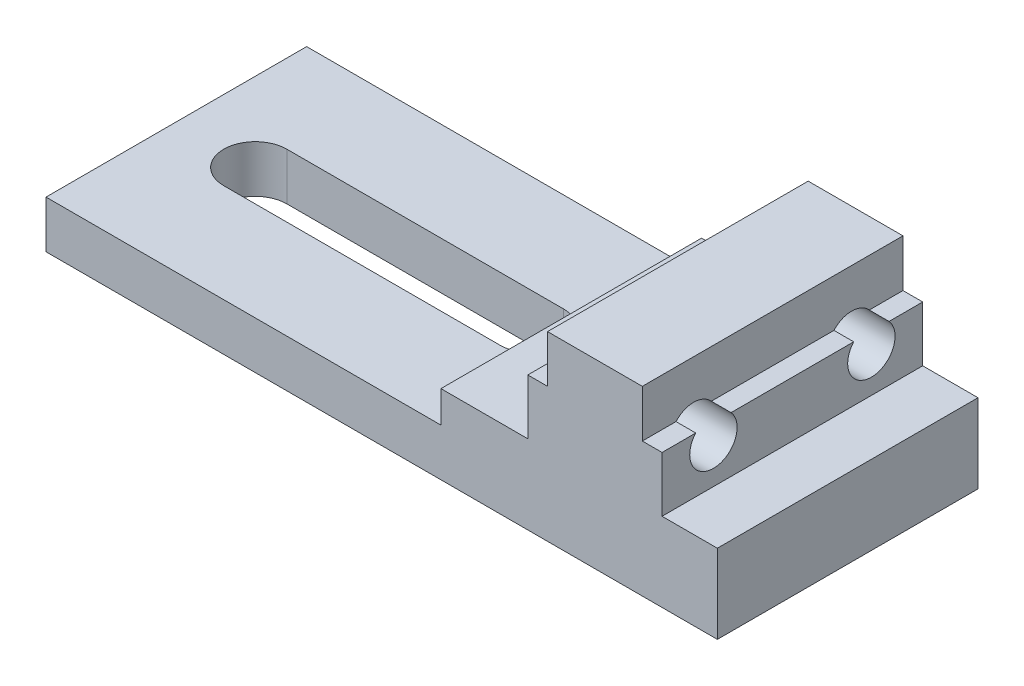
from build123d import *

# Parameters (mm, degrees)
EXTRUDE_1_DEPTH     = 16.5
CUT_EXTRUDE_1_DEPTH = 89.239730281
SKETCH_3_R          = 3
CUT_EXTRUDE_2_DEPTH = 33


with BuildPart() as part:
    # 草圖1 → 填料-伸長1 (new, symmetric)
    with BuildSketch(Plane.XY):
        Polygon((0, 0), (85, 0), (85, 10), (78, 10), (78, 17), (75.5, 17), (75.5, 23), (63.5, 23), (63.5, 17), (61, 17), (61, 10), (50, 10), (50, 6), (0, 6), align=None)
    extrude(amount=EXTRUDE_1_DEPTH, both=True)

    # 草圖2 → 除料-伸長1 (cut, through all)
    with BuildSketch(Plane(origin=(0, 6, 0), x_dir=(1, 0, 0), z_dir=(0, 1, 0))):
        with BuildLine():
            Line((10, 4), (45, 4))
            ThreePointArc((45, 4), (49, 0), (45, -4))
            Line((45, -4), (10, -4))
            ThreePointArc((10, -4), (6, 0), (10, 4))
        make_face()
    extrude(amount=-CUT_EXTRUDE_1_DEPTH, mode=Mode.SUBTRACT)

    # 草圖3 → 除料-伸長2 (cut)
    with BuildSketch(Plane(origin=(78, 0, 0), x_dir=(0, 0, -1), z_dir=(1, 0, 0))):
        with Locations(Location((-10, 15, 0), (0, 0, 41.810314896))):
            Circle(SKETCH_3_R)
        with Locations(Location((10, 15, 0), (0, 0, 41.810314896))):
            Circle(SKETCH_3_R)
    extrude(amount=-CUT_EXTRUDE_2_DEPTH, mode=Mode.SUBTRACT)


solid = part.part
